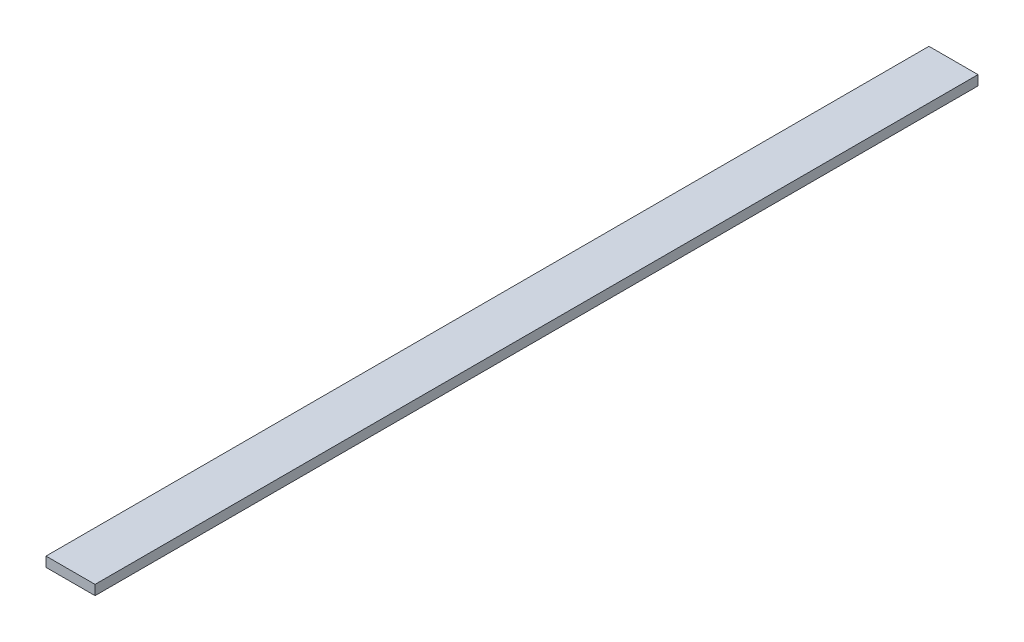
from build123d import *

# Parameters (mm, degrees)
ESQUISSE1_W          = 10
ESQUISSE1_H          = 2
BASE_EXTRUSION_DEPTH = 180


with BuildPart() as part:
    # Esquisse1 → Base-Extrusion (new body)
    with BuildSketch(Plane.XY):
        with Locations((5, 1)):
            Rectangle(ESQUISSE1_W, ESQUISSE1_H)
    extrude(amount=BASE_EXTRUSION_DEPTH)


solid = part.part
